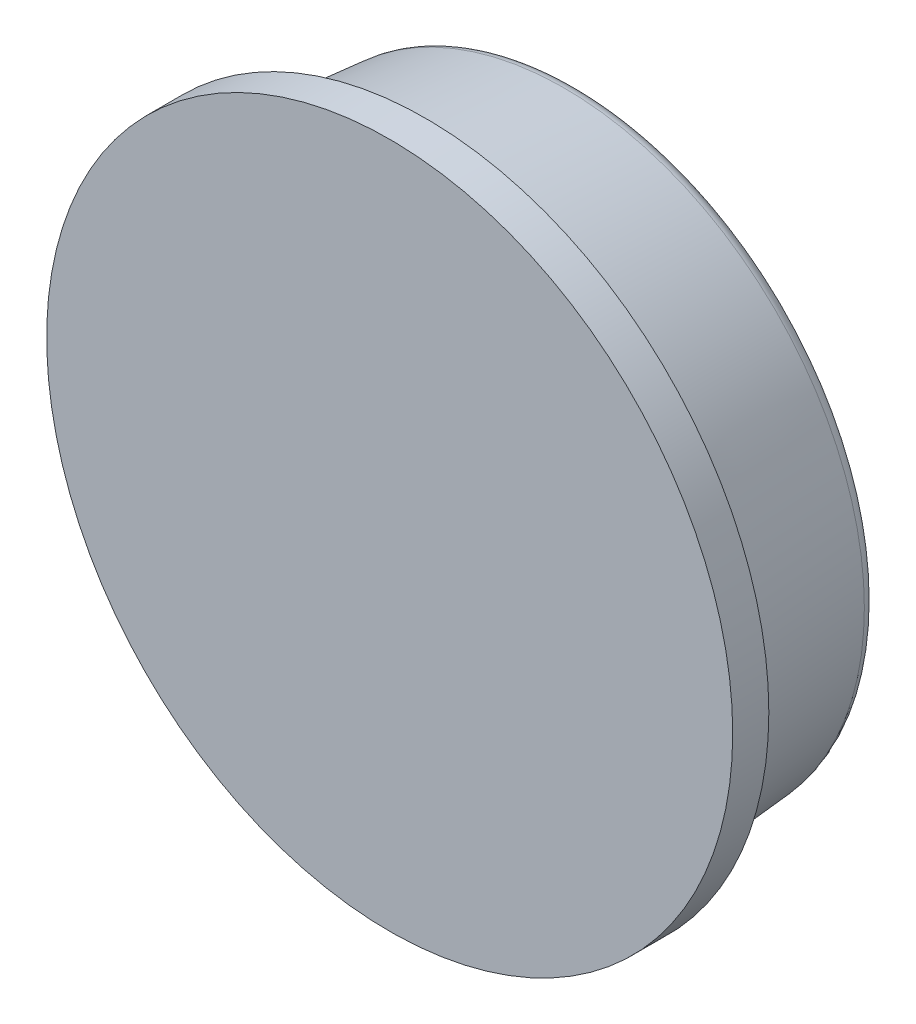
from build123d import *

# Parameters (mm, degrees)
SKETCH2_R           = 6.0325
BOSS_EXTRUDE1_DEPTH = 0.635
SKETCH1_R           = 5.2578
SKETCH3_R           = 5.4864
FILLET1_R           = 0.254


with BuildPart() as part:
    # Sketch2 → Boss-Extrude1 (new body)
    with BuildSketch(Plane.XY.offset(3.302)):
        Circle(SKETCH2_R)
    extrude(amount=-BOSS_EXTRUDE1_DEPTH)

    # Sketch1 → Loft1 section 0
    with BuildSketch(Plane.XY):
        Circle(SKETCH1_R)
    # Sketch3 → Loft1 section 1
    with BuildSketch(Plane(origin=(0, 0, 2.667), x_dir=(-1, 0, 0), z_dir=(0, 0, -1))):
        Circle(SKETCH3_R)
    loft()

    # Fillet1
    fillet1_edges = [part.edges().sort_by_distance(p)[0] for p in [
        (-5.2578, 0, 0),
    ]]
    fillet(fillet1_edges, radius=FILLET1_R)


solid = part.part
